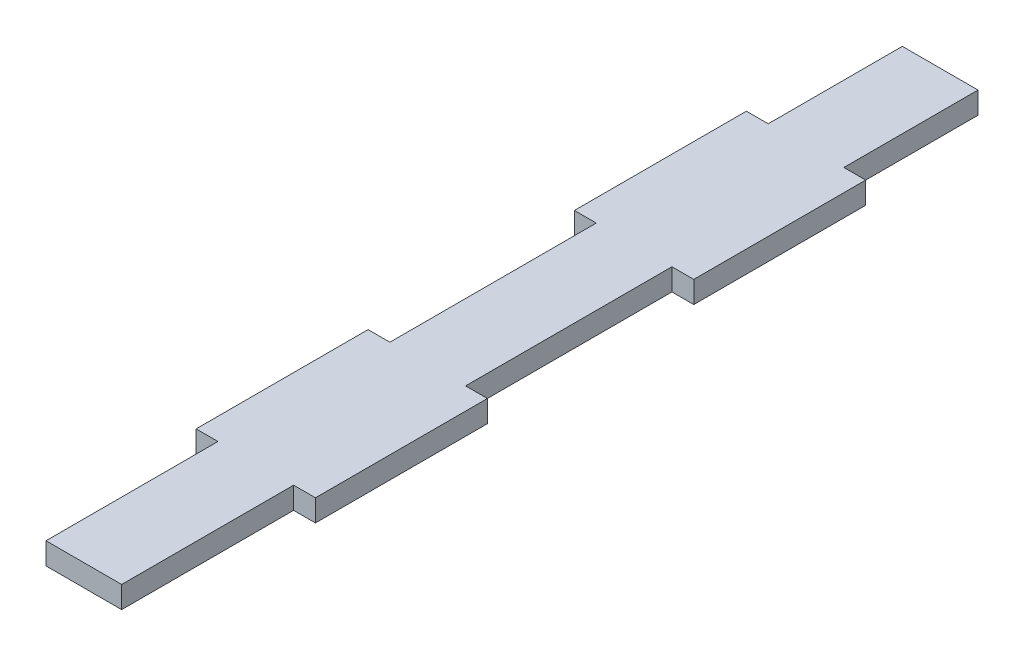
from build123d import *

# Parameters (mm, degrees)
BOSS_EXTRUDE1_DEPTH = 6.35


with BuildPart() as part:
    # Sketch1 → Boss-Extrude1 (new body)
    with BuildSketch(Plane(origin=(0, 0, 0), x_dir=(1, 0, 0), z_dir=(0, 1, 0))):
        Polygon((0, 0), (22, 0), (22, 50), (28.35, 50), (28.35, 100), (22, 100), (22, 160), (28.35, 160), (28.35, 210), (22, 210), (22, 249), (0, 249), (0, 210), (-6.35, 210), (-6.35, 160), (0, 160), (0, 100), (-6.35, 100), (-6.35, 50), (0, 50), align=None)
    extrude(amount=BOSS_EXTRUDE1_DEPTH)


solid = part.part
